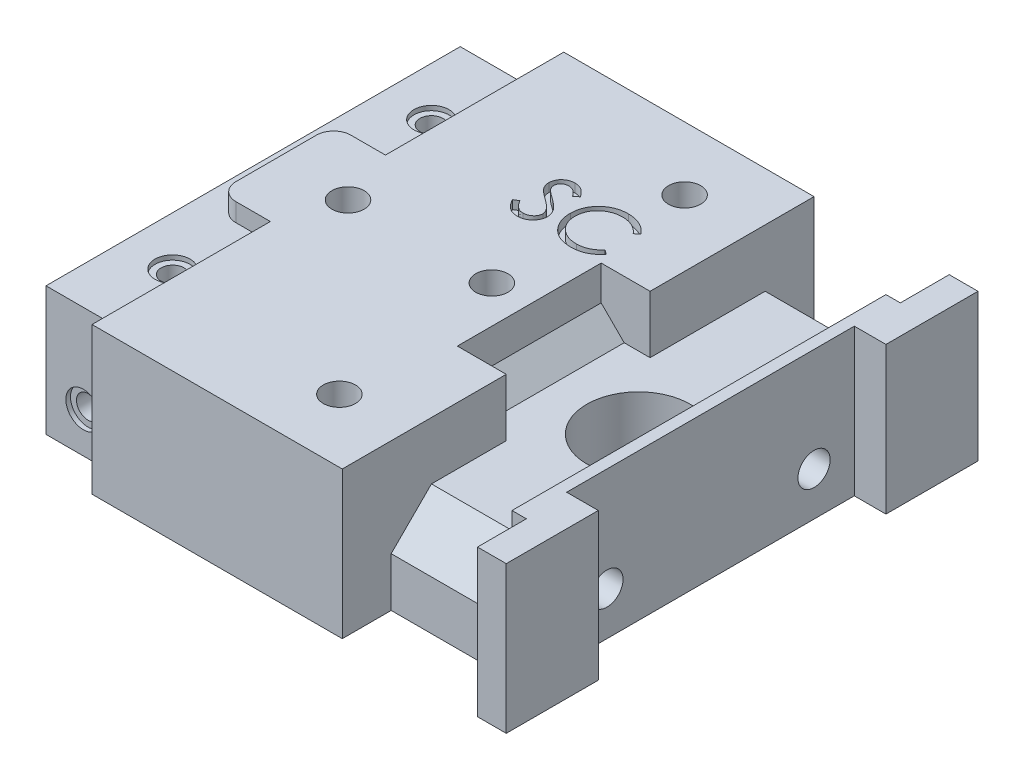
from build123d import *

# Parameters (mm, degrees)
BOSS_EXTRU_3_DEPTH       = 41
ESQUISSE8_W              = 50
ESQUISSE8_H              = 25.55
ENL_V_MAT_EXTRU_1_DEPTH  = 5.5
ESQUISSE9_R              = 9
ENL_V_MAT_EXTRU_2_DEPTH  = 96.644145142
ESQUISSE13_W             = 21
ESQUISSE13_H             = 15.55
ENL_V_MAT_EXTRU_5_DEPTH  = 8.5
CHANFREIN2_SIZE          = 7
ENL_V_MAT_EXTRU_6_DEPTH  = 3.175
ESQUISSE16_R             = 2
ENL_V_MAT_EXTRU_7_DEPTH  = 10
ESQUISSE17_R             = 3.05
ENL_V_MAT_EXTRU_8_DEPTH  = 0.8
ESQUISSE18_R             = 2.8
ENL_V_MAT_EXTRU_9_DEPTH  = 12
ESQUISSE26_W             = 13
ESQUISSE26_H             = 22.375
ENL_V_MAT_EXTRU_13_DEPTH = 5
ESQUISSE27_R             = 2
ENL_V_MAT_EXTRU_14_DEPTH = 10
ESQUISSE28_R             = 3.05
ENL_V_MAT_EXTRU_15_DEPTH = 0.8
ESQUISSE29_R             = 2.8
ENL_V_MAT_EXTRU_16_DEPTH = 10
ESQUISSE30_W             = 17
ESQUISSE30_H             = 25
ENL_V_MAT_EXTRU_17_DEPTH = 10
CHANFREIN4_SIZE          = 4
ESQUISSE31_R             = 2.8
ENL_V_MAT_EXTRU_18_DEPTH = 10
ESQUISSE32_R             = 2.8
ENL_V_MAT_EXTRU_19_DEPTH = 10
ENL_V_MAT_EXTRU_24_DEPTH = 1.5
ENL_V_MAT_EXTRU_25_REACH = 99.769
ESQUISSE40_W             = 2.5
ESQUISSE40_H             = 8.5
ESQUISSE41_W             = 21
ESQUISSE41_H             = 8.5
ENL_V_MAT_EXTRU_26_DEPTH = 15.55
ESQUISSE43_W             = 2.5
ESQUISSE43_H             = 8.5
ENL_V_MAT_EXTRU_28_DEPTH = 25.55
CONG_2_R                 = 3


with BuildPart() as part:
    # Esquisse7 → Boss.-Extru.3 (new, symmetric)
    with BuildSketch(Plane.XY):
        Polygon((0, 0), (85, 0), (85, 25.55), (77.5, 25.55), (77.5, 15.55), (56.5, 15.55), (56.5, 25.55), (0, 25.55), align=None)
    extrude(amount=BOSS_EXTRU_3_DEPTH, both=True)

    # Esquisse8 → Enlèv. mat.-Extru.1 (cut)
    with BuildSketch(Plane(origin=(85, 0, 0), x_dir=(0, 0, -1), z_dir=(1, 0, 0))):
        with Locations((0, 12.775)):
            Rectangle(ESQUISSE8_W, ESQUISSE8_H)
    extrude(amount=-ENL_V_MAT_EXTRU_1_DEPTH, mode=Mode.SUBTRACT)

    # Esquisse9 → Enlèv. mat.-Extru.2 (cut, through all)
    with BuildSketch(Plane(origin=(0, 15.55, 0), x_dir=(1, 0, 0), z_dir=(0, 1, 0))):
        with Locations(Location((67, 0, 0), (0, 0, 270))):
            Circle(ESQUISSE9_R)
    extrude(amount=-ENL_V_MAT_EXTRU_2_DEPTH, mode=Mode.SUBTRACT)

    # Esquisse13 → Enlèv. mat.-Extru.5 (cut)
    with BuildSketch(Plane.XY.offset(41)):
        with Locations((67, 7.775)):
            Rectangle(ESQUISSE13_W, ESQUISSE13_H)
    extrude(amount=-ENL_V_MAT_EXTRU_5_DEPTH, mode=Mode.SUBTRACT)

    # Chanfrein2
    chanfrein2_edges = [part.edges().sort_by_distance(p)[0] for p in [
        (67, 15.55, 32.5),
    ]]
    chamfer(chanfrein2_edges, length=CHANFREIN2_SIZE)

    # Esquisse14 → Enlèv. mat.-Extru.6 (cut)
    with BuildSketch(Plane(origin=(0, 25.55, 0), x_dir=(1, 0, 0), z_dir=(0, 1, 0))):
        Polygon((0, 41), (13, 41), (13, 10), (4, 10), (4, 0), (0, 0), (0, 10), align=None)
    enl_v_mat_extru_6 = extrude(amount=-ENL_V_MAT_EXTRU_6_DEPTH, mode=Mode.SUBTRACT)

    # Symétrie1: Enlèv. mat.-Extru.6 across plane
    add(enl_v_mat_extru_6.mirror(Plane.XY), mode=Mode.SUBTRACT)

    # Esquisse16 → Enlèv. mat.-Extru.7 (cut)
    with BuildSketch(Plane(origin=(0, 22.375, 0), x_dir=(1, 0, 0), z_dir=(0, 1, 0))):
        with Locations(Location((8.5, 22.5, 0), (0, 0, 270))):
            Circle(ESQUISSE16_R)
    enl_v_mat_extru_7 = extrude(amount=-ENL_V_MAT_EXTRU_7_DEPTH, mode=Mode.SUBTRACT)

    # Esquisse17 → Enlèv. mat.-Extru.8 (cut)
    with BuildSketch(Plane(origin=(0, 22.375, 0), x_dir=(1, 0, 0), z_dir=(0, 1, 0))):
        with Locations(Location((8.5, 22.5, 0), (0, 0, 270))):
            Circle(ESQUISSE17_R)
    enl_v_mat_extru_8 = extrude(amount=-ENL_V_MAT_EXTRU_8_DEPTH, mode=Mode.SUBTRACT)

    # Symétrie2: Enlèv. mat.-Extru.7, Enlèv. mat.-Extru.8 across plane
    add(enl_v_mat_extru_7.mirror(Plane.XY), mode=Mode.SUBTRACT)
    add(enl_v_mat_extru_8.mirror(Plane.XY), mode=Mode.SUBTRACT)

    # Esquisse18 → Enlèv. mat.-Extru.9 (cut)
    with BuildSketch(Plane(origin=(79.5, 0, 0), x_dir=(0, 0, -1), z_dir=(1, 0, 0))):
        with Locations((18, 7.55)):
            Circle(ESQUISSE18_R)
    enl_v_mat_extru_9 = extrude(amount=-ENL_V_MAT_EXTRU_9_DEPTH, mode=Mode.SUBTRACT)

    # Symétrie3: Enlèv. mat.-Extru.9 across plane
    add(enl_v_mat_extru_9.mirror(Plane.XY), mode=Mode.SUBTRACT)

    # Esquisse26 → Enlèv. mat.-Extru.13 (cut)
    with BuildSketch(Plane(origin=(0, 0, -41), x_dir=(-1, 0, 0), z_dir=(0, 0, -1))):
        with Locations((-6.5, 11.1875)):
            Rectangle(ESQUISSE26_W, ESQUISSE26_H)
    enl_v_mat_extru_13 = extrude(amount=-ENL_V_MAT_EXTRU_13_DEPTH, mode=Mode.SUBTRACT)

    # Esquisse27 → Enlèv. mat.-Extru.14 (cut)
    with BuildSketch(Plane(origin=(0, 0, -36), x_dir=(-1, 0, 0), z_dir=(0, 0, -1))):
        with Locations((-6.5, 7)):
            Circle(ESQUISSE27_R)
    enl_v_mat_extru_14 = extrude(amount=-ENL_V_MAT_EXTRU_14_DEPTH, mode=Mode.SUBTRACT)

    # Esquisse28 → Enlèv. mat.-Extru.15 (cut)
    with BuildSketch(Plane(origin=(0, 0, -36), x_dir=(-1, 0, 0), z_dir=(0, 0, -1))):
        with Locations((-6.5, 7)):
            Circle(ESQUISSE28_R)
    enl_v_mat_extru_15 = extrude(amount=-ENL_V_MAT_EXTRU_15_DEPTH, mode=Mode.SUBTRACT)

    # Symétrie4: Enlèv. mat.-Extru.13, Enlèv. mat.-Extru.14, Enlèv. mat.-Extru.15 across plane
    add(enl_v_mat_extru_13.mirror(Plane.XY), mode=Mode.SUBTRACT)
    add(enl_v_mat_extru_14.mirror(Plane.XY), mode=Mode.SUBTRACT)
    add(enl_v_mat_extru_15.mirror(Plane.XY), mode=Mode.SUBTRACT)

    # Esquisse29 → Enlèv. mat.-Extru.16 (cut)
    with BuildSketch(Plane(origin=(0, 25.55, 0), x_dir=(1, 0, 0), z_dir=(0, 1, 0))):
        with Locations(Location((41.5, 0, 0), (0, 0, 270))):
            Circle(ESQUISSE29_R)
        with Locations(Location((16.5, 0, 0), (0, 0, 270))):
            Circle(ESQUISSE29_R)
    extrude(amount=-ENL_V_MAT_EXTRU_16_DEPTH, mode=Mode.SUBTRACT)

    # Esquisse30 → Enlèv. mat.-Extru.17 (cut)
    with BuildSketch(Plane(origin=(0, 25.55, 0), x_dir=(1, 0, 0), z_dir=(0, 1, 0))):
        with Locations((56.5, 0)):
            Rectangle(ESQUISSE30_W, ESQUISSE30_H)
    extrude(amount=-ENL_V_MAT_EXTRU_17_DEPTH, mode=Mode.SUBTRACT)

    # Chanfrein4
    chanfrein4_edges = [part.edges().sort_by_distance(p)[0] for p in [
        (48, 15.55, 0),
    ]]
    chamfer(chanfrein4_edges, length=CHANFREIN4_SIZE)

    # Esquisse31 → Enlèv. mat.-Extru.18 (cut)
    with BuildSketch(Plane(origin=(0, 25.55, 0), x_dir=(1, 0, 0), z_dir=(0, 1, 0))):
        with Locations(Location((45, -30, 0), (0, 0, 270))):
            Circle(ESQUISSE31_R)
        with Locations(Location((45, 30, 0), (0, 0, 270))):
            Circle(ESQUISSE31_R)
    extrude(amount=-ENL_V_MAT_EXTRU_18_DEPTH, mode=Mode.SUBTRACT)

    # Esquisse32 → Enlèv. mat.-Extru.19 (cut)
    with BuildSketch(Plane.XZ):
        with Locations(Location((11, -15, 0), (0, 0, 270))):
            Circle(ESQUISSE32_R)
        with Locations(Location((43, 15, 0), (0, 0, 270))):
            Circle(ESQUISSE32_R)
    extrude(amount=-ENL_V_MAT_EXTRU_19_DEPTH, mode=Mode.SUBTRACT)

    # Esquisse39 → Enlèv. mat.-Extru.24 (cut)
    with BuildSketch(Plane(origin=(0, 25.55, 0), x_dir=(1, 0, 0), z_dir=(0, 1, 0))):
        with BuildLine():
            Line((30.744230769, 14.337454928), (31.549429087, 14.820192308))
            add(Edge.make_bspline(
                [(31.549429087, 14.820192308), (31.624318004, 14.694831374), (31.767802279, 14.454644664), (32.00715562, 14.130092425), (32.255167329, 13.854242556), (32.513674015, 13.628699788), (32.781097774, 13.451129604), (33.059184377, 13.32539353), (33.346996705, 13.246972911), (33.542868319, 13.237447676), (33.640655048, 13.232692308)],
                knots=[0, 0, 0, 0, 1.272034388, 2.437168799, 3.508375237, 4.49857839, 5.41946034, 6.295179144, 7.148887113, 8, 8, 8, 8], degree=3))
            add(Edge.make_bspline(
                [(33.640655048, 13.232692308), (33.724167147, 13.235018238), (33.889730079, 13.2396294), (34.133467326, 13.28393644), (34.370182088, 13.352005162), (34.594995595, 13.449489269), (34.804805803, 13.567431862), (34.988792596, 13.709888245), (35.147849518, 13.869380848), (35.277958608, 14.047315072), (35.377780704, 14.238678169), (35.454503405, 14.435099865), (35.497080355, 14.639665755), (35.503494091, 14.777398514), (35.506730769, 14.846905048)],
                knots=[0, 0, 0, 0, 1.095163259, 2.171163733, 3.241058638, 4.321873601, 5.38011039, 6.391990106, 7.366004449, 8.327778327, 9.272591725, 10.192022065, 11.087607919, 12, 12, 12, 12], degree=3))
            add(Edge.make_bspline(
                [(35.506730769, 14.846905048), (35.502718538, 14.926209789), (35.494562258, 15.087424739), (35.425624444, 15.325276652), (35.317177566, 15.560660003), (35.217130657, 15.706259876), (35.165189303, 15.781850962)],
                knots=[0, 0, 0, 0, 0.938893495, 1.908633276, 2.914225137, 4, 4, 4, 4], degree=3))
            add(Edge.make_bspline(
                [(35.165189303, 15.781850962), (35.122542846, 15.83640696), (35.033011943, 15.950940455), (34.879094713, 16.121424988), (34.698484073, 16.2972794), (34.497360827, 16.485218691), (34.268398635, 16.676501909), (34.018768757, 16.88025058), (33.742097826, 17.0887163), (33.548061339, 17.228523068), (33.447941707, 17.300661058)],
                knots=[0, 0, 0, 0, 0.722233717, 1.516239348, 2.393582979, 3.351407094, 4.387010283, 5.505090956, 6.712668013, 8, 8, 8, 8], degree=3))
            add(Edge.make_bspline(
                [(33.447941707, 17.300661058), (33.347727831, 17.372040285), (33.156126533, 17.508511933), (32.888178534, 17.711052306), (32.648571817, 17.896228837), (32.43837135, 18.065784756), (32.25766959, 18.219743059), (32.105042593, 18.356625307), (31.984378377, 18.480133426), (31.917279975, 18.560255935), (31.887154447, 18.596228966)],
                knots=[0, 0, 0, 0, 1.452282411, 2.77665338, 3.964542531, 5.026858415, 5.96415736, 6.766646006, 7.446254459, 8, 8, 8, 8], degree=3))
            add(Edge.make_bspline(
                [(31.887154447, 18.596228966), (31.84504702, 18.652293217), (31.762237115, 18.762551089), (31.6529282, 18.934885166), (31.560020907, 19.111297053), (31.487189132, 19.292260799), (31.425858422, 19.475235855), (31.384607196, 19.662609602), (31.358777037, 19.853541271), (31.356131845, 19.982029441), (31.354807692, 20.046349159)],
                knots=[0, 0, 0, 0, 1.068054152, 2.10047183, 3.106115577, 4.101338837, 5.06977816, 6.043150881, 7.020423561, 8, 8, 8, 8], degree=3))
            add(Edge.make_bspline(
                [(31.354807692, 20.046349159), (31.358359725, 20.147123045), (31.365387869, 20.346516847), (31.424825277, 20.637793607), (31.518640795, 20.915886643), (31.650071882, 21.178042765), (31.819500821, 21.417435899), (32.015568794, 21.636819745), (32.249098625, 21.821247101), (32.505328264, 21.982388489), (32.785788819, 22.108515614), (33.079678349, 22.203659424), (33.387463952, 22.257568904), (33.595933912, 22.265305286), (33.70171274, 22.269230769)],
                knots=[0, 0, 0, 0, 1.005424448, 1.989358655, 2.955360095, 3.929531133, 4.905563448, 5.876582895, 6.856512386, 7.866279853, 8.892233794, 9.918561126, 10.94386622, 12, 12, 12, 12], degree=3))
            add(Edge.make_bspline(
                [(33.70171274, 22.269230769), (33.813955613, 22.265359397), (34.037170863, 22.257660472), (34.365509086, 22.190720048), (34.681632178, 22.079956077), (34.935931349, 21.954256943), (35.134956936, 21.82871359), (35.286738444, 21.71435964), (35.440546649, 21.582710237), (35.597622213, 21.433414718), (35.755303579, 21.265103202), (35.915931688, 21.078928399), (36.079882162, 20.876028057), (36.185353467, 20.73118138), (36.239423077, 20.656926082)],
                knots=[0, 0, 0, 0, 1.286793592, 2.559021753, 3.825965368, 5.121522368, 5.803751409, 6.523245864, 7.299691795, 8.125521123, 9.008227632, 9.944561021, 10.946284179, 12, 12, 12, 12], degree=3))
            Line((36.239423077, 20.656926082), (35.466661659, 20.071153846))
            add(Edge.make_bspline(
                [(35.466661659, 20.071153846), (35.420000228, 20.131266639), (35.330141223, 20.247029824), (35.193717405, 20.409148905), (35.065133585, 20.557239467), (34.938449997, 20.685868137), (34.820357328, 20.802078942), (34.705738806, 20.901573709), (34.596243893, 20.985327294), (34.458221443, 21.074708696), (34.284818224, 21.163308895), (34.067146022, 21.238281743), (33.839671945, 21.283335162), (33.684742019, 21.289292063), (33.606310096, 21.292307692)],
                knots=[0, 0, 0, 0, 1.181633172, 2.275549214, 3.290209073, 4.226197932, 5.078386478, 5.862611352, 6.581680152, 7.217281963, 8.414376989, 9.595101626, 10.782541182, 12, 12, 12, 12], degree=3))
            add(Edge.make_bspline(
                [(33.606310096, 21.292307692), (33.507912703, 21.289010137), (33.3181626, 21.282651114), (33.048767743, 21.213200296), (32.80630499, 21.103848234), (32.597972652, 20.950591043), (32.424517022, 20.769014628), (32.299044309, 20.560066458), (32.223524218, 20.329337205), (32.2143087, 20.168387412), (32.209615385, 20.086418269)],
                knots=[0, 0, 0, 0, 1.14458467, 2.207223713, 3.21896685, 4.227309161, 5.202851033, 6.127160689, 7.046193047, 8, 8, 8, 8], degree=3))
            add(Edge.make_bspline(
                [(32.209615385, 20.086418269), (32.210685251, 20.03538746), (32.212826732, 19.933242395), (32.24269386, 19.782335311), (32.281064177, 19.631809452), (32.341868053, 19.482341566), (32.425811344, 19.331317632), (32.536043287, 19.176137046), (32.674872372, 19.015432039), (32.78121767, 18.910909114), (32.837364784, 18.855724159)],
                knots=[0, 0, 0, 0, 0.858281714, 1.717966888, 2.583508476, 3.4729293, 4.427298488, 5.488583878, 6.674047936, 8, 8, 8, 8], degree=3))
            add(Edge.make_bspline(
                [(32.837364784, 18.855724159), (32.858214661, 18.837117681), (32.907749198, 18.79291295), (32.998307253, 18.720543958), (33.11789444, 18.631273556), (33.263388002, 18.520818073), (33.437470608, 18.392689237), (33.6401614, 18.248525335), (33.869201, 18.083646336), (34.031729928, 17.968373315), (34.117668269, 17.907421875)],
                knots=[0, 0, 0, 0, 0.420754252, 0.999615792, 1.744751191, 2.668019286, 3.750313428, 4.999500688, 6.413464383, 8, 8, 8, 8], degree=3))
            add(Edge.make_bspline(
                [(34.117668269, 17.907421875), (34.221044219, 17.832197889), (34.421217418, 17.686537067), (34.706035546, 17.467691538), (34.964282267, 17.253657253), (35.196864271, 17.045801051), (35.406079286, 16.845699598), (35.589606226, 16.650945514), (35.749315113, 16.462934063), (35.921252843, 16.221890125), (36.096942338, 15.925850174), (36.24782244, 15.563142968), (36.342959086, 15.199025838), (36.355400139, 14.954296376), (36.361538462, 14.833548678)],
                knots=[0, 0, 0, 0, 1.163667725, 2.253281268, 3.268753668, 4.215851969, 5.092017293, 5.902905408, 6.650798638, 7.335211899, 8.59617414, 9.77448103, 10.901945474, 12, 12, 12, 12], degree=3))
            add(Edge.make_bspline(
                [(36.361538462, 14.833548678), (36.359750107, 14.748154699), (36.356208127, 14.579025033), (36.315493069, 14.33068086), (36.255840266, 14.089478279), (36.165931793, 13.858398751), (36.056195198, 13.63321479), (35.916949909, 13.41983329), (35.755548282, 13.213531591), (35.57039925, 13.019810803), (35.367800044, 12.841975799), (35.15366799, 12.68378171), (34.927652604, 12.55187863), (34.690979985, 12.444243838), (34.443595769, 12.36006048), (34.185583157, 12.299065457), (33.916516844, 12.261630273), (33.733635534, 12.257744722), (33.640655048, 12.255769231)],
                knots=[0, 0, 0, 0, 0.983748083, 1.948392443, 2.894712957, 3.844097841, 4.80183111, 5.778335162, 6.776009319, 7.81870978, 8.863265674, 9.881300176, 10.883814829, 11.87499822, 12.874611388, 13.892143829, 14.928324115, 16, 16, 16, 16], degree=3))
            add(Edge.make_bspline(
                [(33.640655048, 12.255769231), (33.56871315, 12.257160375), (33.425735389, 12.259925143), (33.214254585, 12.284367057), (33.007046131, 12.318948531), (32.806710121, 12.373850822), (32.610665451, 12.440463166), (32.419764763, 12.522482486), (32.233915537, 12.62077287), (32.052076258, 12.73315433), (31.874709397, 12.863940049), (31.70347856, 13.016267921), (31.532765562, 13.18593676), (31.367609148, 13.377554079), (31.204668662, 13.588024147), (31.047156705, 13.819316139), (30.891812887, 14.070170223), (30.79434365, 14.246695921), (30.744230769, 14.337454928)],
                knots=[0, 0, 0, 0, 0.915332311, 1.819136955, 2.706846663, 3.586547465, 4.459518054, 5.340707479, 6.227863349, 7.133153174, 8.059268498, 9.028702269, 10.047606654, 11.120612155, 12.245963614, 13.433783089, 14.680604001, 16, 16, 16, 16], degree=3))
        make_face()
        with BuildLine():
            Line((47.107692308, 20.277223558), (46.359735577, 19.704807692))
            add(Edge.make_bspline(
                [(46.359735577, 19.704807692), (46.306379552, 19.76839651), (46.200386858, 19.894716831), (46.029864314, 20.072098305), (45.852150557, 20.238283053), (45.66731352, 20.394062739), (45.472026202, 20.533989795), (45.271019314, 20.665356153), (45.060930348, 20.783106212), (44.770413127, 20.925880481), (44.390371483, 21.074868231), (43.911958385, 21.199790597), (43.412546039, 21.279313939), (43.071829714, 21.287926829), (42.898527644, 21.292307692)],
                knots=[0, 0, 0, 0, 0.757959112, 1.505699292, 2.245454638, 2.979532153, 3.711538275, 4.438200793, 5.171680507, 5.909471876, 7.393775596, 8.890124382, 10.418191784, 12, 12, 12, 12], degree=3))
            add(Edge.make_bspline(
                [(42.898527644, 21.292307692), (42.803050951, 21.291208337), (42.612983678, 21.28901983), (42.330911761, 21.260147854), (42.054106958, 21.219568061), (41.782749325, 21.159355574), (41.517184273, 21.083230089), (41.255675665, 20.992265213), (41.002009675, 20.87972097), (40.752677184, 20.755329205), (40.513792331, 20.614828802), (40.287763951, 20.461576037), (40.07541641, 20.297285853), (39.87658173, 20.121342485), (39.691056642, 19.934538293), (39.52018546, 19.734882477), (39.364559451, 19.523013348), (39.221093833, 19.301724718), (39.092607751, 19.071661156), (38.985030008, 18.831971143), (38.889766068, 18.586759263), (38.814384558, 18.333255032), (38.754718552, 18.073242219), (38.713549697, 17.806023003), (38.685006071, 17.532155633), (38.682828447, 17.34652886), (38.681730769, 17.252959736)],
                knots=[0, 0, 0, 0, 1.054917814, 2.100044995, 3.131103042, 4.146048494, 5.169673617, 6.183595914, 7.203665975, 8.234915748, 9.262203917, 10.264457458, 11.251630812, 12.227803204, 13.197192746, 14.159520551, 15.12972552, 16.100847026, 17.073214652, 18.039054194, 19.002613845, 19.979014051, 20.95965708, 21.949030935, 22.966165397, 24, 24, 24, 24], degree=3))
            add(Edge.make_bspline(
                [(38.681730769, 17.252959736), (38.68516472, 17.112176644), (38.691906826, 16.835767716), (38.751909792, 16.430899126), (38.843091505, 16.043039292), (38.97974961, 15.674612722), (39.148257884, 15.321076404), (39.361184119, 14.988412096), (39.607790553, 14.671592731), (39.891565938, 14.378105852), (40.202913194, 14.110007785), (40.536962868, 13.873922274), (40.892882965, 13.677122487), (41.266743652, 13.513357947), (41.661421862, 13.387473566), (42.07620786, 13.29885263), (42.510199504, 13.241043553), (42.806751942, 13.235509016), (42.957677284, 13.232692308)],
                knots=[0, 0, 0, 0, 1.029171465, 2.020641659, 2.987623507, 3.938342917, 4.889210282, 5.84687017, 6.821220943, 7.821438502, 8.827599549, 9.822697543, 10.807740252, 11.797342354, 12.80366471, 13.83203677, 14.896651826, 16, 16, 16, 16], degree=3))
            add(Edge.make_bspline(
                [(42.957677284, 13.232692308), (43.123963887, 13.237288201), (43.451255702, 13.246334019), (43.931228688, 13.322967404), (44.390703165, 13.447222166), (44.829703847, 13.621115798), (45.246993134, 13.847172045), (45.643224045, 14.121214126), (46.018731033, 14.445848803), (46.244531451, 14.693725031), (46.359735577, 14.820192308)],
                knots=[0, 0, 0, 0, 1.028121516, 2.023589091, 2.998037872, 3.967518031, 4.937445131, 5.927275754, 6.942489185, 8, 8, 8, 8], degree=3))
            Line((46.359735577, 14.820192308), (47.107692308, 14.253500601))
            add(Edge.make_bspline(
                [(47.107692308, 14.253500601), (47.047499452, 14.175835243), (46.92740206, 14.020876538), (46.73293417, 13.802422814), (46.528072383, 13.596943975), (46.311295057, 13.406096662), (46.085095925, 13.22606201), (45.845413417, 13.061954883), (45.595398408, 12.911484691), (45.335898004, 12.773707132), (45.067187922, 12.651468053), (44.789590139, 12.54681887), (44.504301215, 12.456671849), (44.21130811, 12.38250765), (43.910003086, 12.324619915), (43.601473439, 12.285922085), (43.285053279, 12.259410161), (43.071580554, 12.256993762), (42.963401442, 12.255769231)],
                knots=[0, 0, 0, 0, 0.986787822, 1.968848986, 2.935600012, 3.899624008, 4.868462664, 5.837806735, 6.815139263, 7.798259679, 8.787526145, 9.778297419, 10.776456485, 11.791383307, 12.812564526, 13.85620153, 14.913611965, 16, 16, 16, 16], degree=3))
            add(Edge.make_bspline(
                [(42.963401442, 12.255769231), (42.860956891, 12.256482225), (42.658385477, 12.257892082), (42.359303875, 12.280730766), (42.068139373, 12.311890408), (41.785724141, 12.358808193), (41.510517023, 12.414173861), (41.245012861, 12.488390638), (40.986599039, 12.571528013), (40.736313769, 12.66924087), (40.493944157, 12.779502766), (40.260271928, 12.904121223), (40.035404551, 13.042048298), (39.817131227, 13.190243719), (39.608676374, 13.353467662), (39.408233566, 13.529453289), (39.214678827, 13.717607446), (39.094928663, 13.853283869), (39.034720553, 13.921499399)],
                knots=[0, 0, 0, 0, 1.114604814, 2.203992996, 3.262667896, 4.300477797, 5.318619304, 6.316056647, 7.298880507, 8.271930387, 9.238335007, 10.195173496, 11.151986948, 12.108099108, 13.064862484, 14.031167946, 15.010108607, 16, 16, 16, 16], degree=3))
            add(Edge.make_bspline(
                [(39.034720553, 13.921499399), (38.93828498, 14.039993635), (38.74657809, 14.275551539), (38.501307479, 14.657329817), (38.291355919, 15.055932585), (38.121604306, 15.473453963), (37.98890001, 15.908957067), (37.896966901, 16.362661431), (37.837227177, 16.834143331), (37.830395606, 17.154827734), (37.826923077, 17.317833534)],
                knots=[0, 0, 0, 0, 0.994628077, 1.977248131, 2.950237994, 3.925870899, 4.908910175, 5.911660606, 6.938484602, 8, 8, 8, 8], degree=3))
            add(Edge.make_bspline(
                [(37.826923077, 17.317833534), (37.831155425, 17.489162304), (37.839482306, 17.826240963), (37.910228006, 18.320925793), (38.024034873, 18.794866385), (38.185679263, 19.247178004), (38.390617398, 19.680239696), (38.643782682, 20.09074326), (38.942233977, 20.481313979), (39.283630571, 20.846025553), (39.658010248, 21.179507648), (40.058927877, 21.472894531), (40.485598747, 21.717054342), (40.933322329, 21.921151041), (41.40545122, 22.07802633), (41.900978103, 22.187844646), (42.418971864, 22.256199084), (42.77238318, 22.264840185), (42.951953125, 22.269230769)],
                knots=[0, 0, 0, 0, 1.032925535, 2.032216505, 3.007276963, 3.968222605, 4.92396291, 5.891752235, 6.871517503, 7.883894988, 8.900124299, 9.891468569, 10.874487609, 11.85992873, 12.854644235, 13.869047385, 14.917252991, 16, 16, 16, 16], degree=3))
            add(Edge.make_bspline(
                [(42.951953125, 22.269230769), (43.061393938, 22.267918665), (43.278021006, 22.265321486), (43.598476438, 22.239995485), (43.910467342, 22.197776313), (44.214208658, 22.140310438), (44.511178063, 22.068989084), (44.799105862, 21.976078701), (45.079681574, 21.869843569), (45.351135659, 21.747492316), (45.6121657, 21.610150684), (45.862690395, 21.459341022), (46.10071976, 21.295250294), (46.327928698, 21.119274081), (46.540516387, 20.927689431), (46.744518696, 20.725765973), (46.933007773, 20.507687495), (47.049357539, 20.354185496), (47.107692308, 20.277223558)],
                knots=[0, 0, 0, 0, 1.096760587, 2.17092713, 3.219439832, 4.250915756, 5.268269357, 6.278326846, 7.281116186, 8.274029601, 9.260640565, 10.235837813, 11.203064059, 12.156899882, 13.114053108, 14.069676657, 15.032185724, 16, 16, 16, 16], degree=3))
        make_face()
    extrude(amount=-ENL_V_MAT_EXTRU_24_DEPTH, mode=Mode.SUBTRACT)

    # Esquisse40 → Enlèv. mat.-Extru.25 (cut, up to next)
    with BuildSketch(Plane(origin=(0, 25.55, 0), x_dir=(1, 0, 0), z_dir=(0, 1, 0)), mode=Mode.PRIVATE) as enl_v_mat_extru_25_sk1:
        with Locations((78.75, -36.75)):
            Rectangle(ESQUISSE40_W, ESQUISSE40_H)
    enl_v_mat_extru_25_tool1 = extrude(enl_v_mat_extru_25_sk1.sketch, amount=-ENL_V_MAT_EXTRU_25_REACH, mode=Mode.PRIVATE) & part.part
    add(enl_v_mat_extru_25_tool1.solids().sort_by_distance((78.75, 25.55, 36.75))[0], mode=Mode.SUBTRACT)

    # Esquisse41 → Enlèv. mat.-Extru.26 (cut)
    with BuildSketch(Plane(origin=(0, 15.55, 0), x_dir=(1, 0, 0), z_dir=(0, 1, 0))):
        with Locations((67, 36.75)):
            Rectangle(ESQUISSE41_W, ESQUISSE41_H)
    extrude(amount=-ENL_V_MAT_EXTRU_26_DEPTH, mode=Mode.SUBTRACT)

    # Esquisse43 → Enlèv. mat.-Extru.28 (cut)
    with BuildSketch(Plane(origin=(0, 25.55, 0), x_dir=(1, 0, 0), z_dir=(0, 1, 0))):
        with Locations((78.75, 36.75)):
            Rectangle(ESQUISSE43_W, ESQUISSE43_H)
    extrude(amount=-ENL_V_MAT_EXTRU_28_DEPTH, mode=Mode.SUBTRACT)

    # Congé2
    cong_2_edges = [part.edges().sort_by_distance(p)[0] for p in [
        (4, 23.9625, -10),
        (4, 23.9625, 10),
    ]]
    fillet(cong_2_edges, radius=CONG_2_R)


solid = part.part
